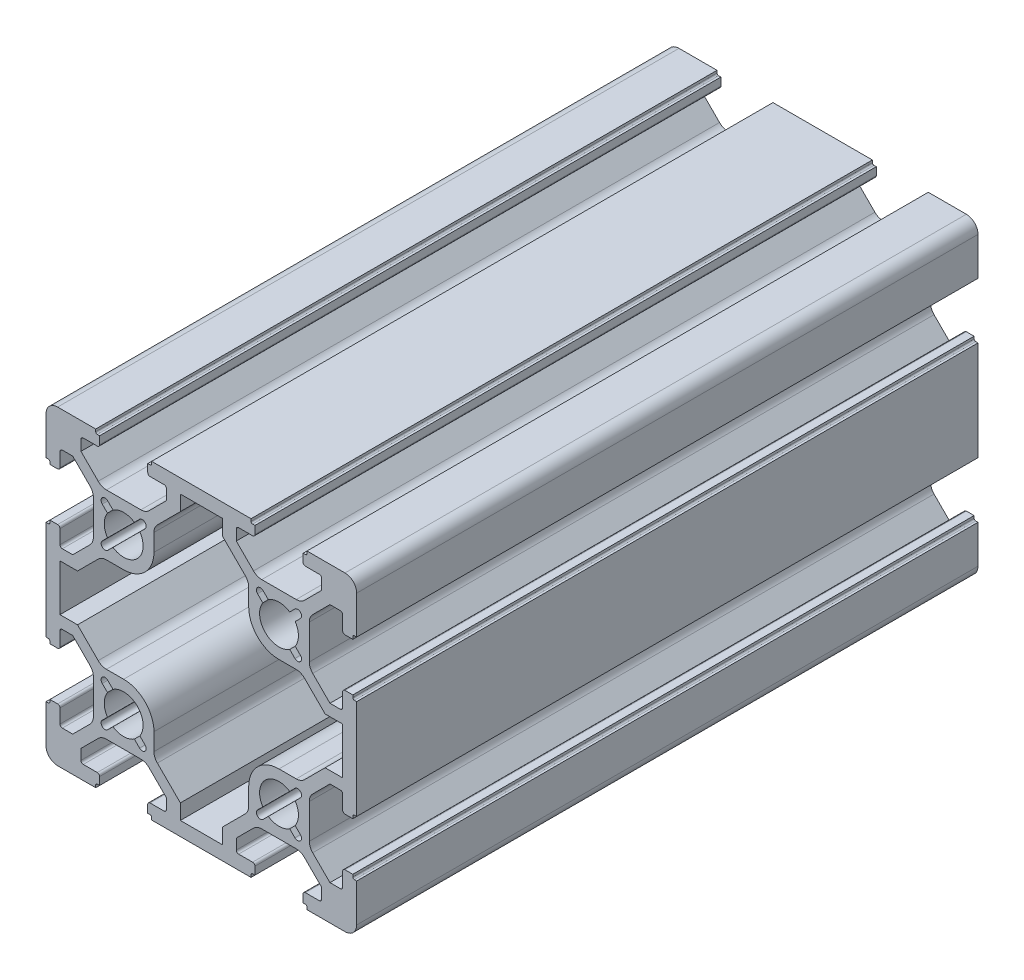
from build123d import *

# Parameters (mm, degrees)
EXTRUDE_1_DEPTH = 80


with BuildPart() as part:
    # 草图1 → 凸台-拉伸1 (new body)
    with BuildSketch(Plane.XY):
        with BuildLine():
            Line((583.863926702, 206.538663668), (578.963926702, 206.538663668))
            Line((578.963926702, 206.538663668), (578.963926702, 206.238663668))
            ThreePointArc((578.963926702, 206.238663668), (578.905348058, 206.097242312), (578.763926702, 206.038663668))
            Line((578.763926702, 206.038663668), (578.463926702, 206.038663668))
            Line((578.463926702, 206.038663668), (578.463926702, 205.038663668))
            ThreePointArc((578.463926702, 205.038663668), (578.551794668, 204.826531634), (578.763926702, 204.738663668))
            Line((578.763926702, 204.738663668), (580.563926702, 204.738663668))
            ThreePointArc((580.563926702, 204.738663668), (580.776058736, 204.650795703), (580.863926702, 204.438663668))
            Line((580.863926702, 204.438663668), (580.863926702, 203.098663668))
            Line((580.863926702, 203.098663668), (578.64326653, 200.878003496))
            ThreePointArc((578.64326653, 200.878003496), (578.156631507, 200.552844369), (577.582606358, 200.438663668))
            Line((577.582606358, 200.438663668), (573.145247045, 200.438663668))
            ThreePointArc((573.145247045, 200.438663668), (572.571221897, 200.552844369), (572.084586874, 200.878003496))
            Line((572.084586874, 200.878003496), (569.863926702, 203.098663668))
            Line((569.863926702, 203.098663668), (569.863926702, 204.438663668))
            ThreePointArc((569.863926702, 204.438663668), (569.951794668, 204.650795703), (570.163926702, 204.738663668))
            Line((570.163926702, 204.738663668), (571.963926702, 204.738663668))
            ThreePointArc((571.963926702, 204.738663668), (572.176058736, 204.826531634), (572.263926702, 205.038663668))
            Line((572.263926702, 205.038663668), (572.263926702, 206.038663668))
            Line((572.263926702, 206.038663668), (571.963926702, 206.038663668))
            ThreePointArc((571.963926702, 206.038663668), (571.822505346, 206.097242312), (571.763926702, 206.238663668))
            Line((571.763926702, 206.238663668), (571.763926702, 206.538663668))
            Line((571.763926702, 206.538663668), (566.863926702, 206.538663668))
            ThreePointArc((566.863926702, 206.538663668), (565.80326653, 206.09932384), (565.363926702, 205.038663668))
            Line((565.363926702, 205.038663668), (565.363926702, 200.138663668))
            Line((565.363926702, 200.138663668), (565.663926702, 200.138663668))
            ThreePointArc((565.663926702, 200.138663668), (565.805348058, 200.080085024), (565.863926702, 199.938663668))
            Line((565.863926702, 199.938663668), (565.863926702, 199.638663668))
            Line((565.863926702, 199.638663668), (566.863926702, 199.638663668))
            ThreePointArc((566.863926702, 199.638663668), (567.076058736, 199.726531634), (567.163926702, 199.938663668))
            Line((567.163926702, 199.938663668), (567.163926702, 201.738663668))
            ThreePointArc((567.163926702, 201.738663668), (567.251794668, 201.950795703), (567.463926702, 202.038663668))
            Line((567.463926702, 202.038663668), (568.803926702, 202.038663668))
            Line((568.803926702, 202.038663668), (571.024586874, 199.818003496))
            ThreePointArc((571.024586874, 199.818003496), (571.349746001, 199.331368473), (571.463926702, 198.757343325))
            Line((571.463926702, 198.757343325), (571.463926702, 194.319984012))
            ThreePointArc((571.463926702, 194.319984012), (571.349746001, 193.745958863), (571.024586874, 193.25932384))
            Line((571.024586874, 193.25932384), (568.803926702, 191.038663668))
            Line((568.803926702, 191.038663668), (567.463926702, 191.038663668))
            ThreePointArc((567.463926702, 191.038663668), (567.251794668, 191.126531634), (567.163926702, 191.338663668))
            Line((567.163926702, 191.338663668), (567.163926702, 193.138663668))
            ThreePointArc((567.163926702, 193.138663668), (567.076058736, 193.350795703), (566.863926702, 193.438663668))
            Line((566.863926702, 193.438663668), (565.863926702, 193.438663668))
            Line((565.863926702, 193.438663668), (565.863926702, 193.138663668))
            ThreePointArc((565.863926702, 193.138663668), (565.805348058, 192.997242312), (565.663926702, 192.938663668))
            Line((565.663926702, 192.938663668), (565.363926702, 192.938663668))
            Line((565.363926702, 192.938663668), (565.363926702, 180.138663668))
            Line((565.363926702, 180.138663668), (565.663926702, 180.138663668))
            ThreePointArc((565.663926702, 180.138663668), (565.805348058, 180.080085024), (565.863926702, 179.938663668))
            Line((565.863926702, 179.938663668), (565.863926702, 179.638663668))
            Line((565.863926702, 179.638663668), (566.863926702, 179.638663668))
            ThreePointArc((566.863926702, 179.638663668), (567.076058736, 179.726531634), (567.163926702, 179.938663668))
            Line((567.163926702, 179.938663668), (567.163926702, 181.738663668))
            ThreePointArc((567.163926702, 181.738663668), (567.251794668, 181.950795703), (567.463926702, 182.038663668))
            Line((567.463926702, 182.038663668), (568.803926702, 182.038663668))
            Line((568.803926702, 182.038663668), (571.024586874, 179.818003496))
            ThreePointArc((571.024586874, 179.818003496), (571.349746001, 179.331368473), (571.463926702, 178.757343325))
            Line((571.463926702, 178.757343325), (571.463926702, 174.319984012))
            ThreePointArc((571.463926702, 174.319984012), (571.349746001, 173.745958863), (571.024586874, 173.25932384))
            Line((571.024586874, 173.25932384), (568.803926702, 171.038663668))
            Line((568.803926702, 171.038663668), (567.463926702, 171.038663668))
            ThreePointArc((567.463926702, 171.038663668), (567.251794668, 171.126531634), (567.163926702, 171.338663668))
            Line((567.163926702, 171.338663668), (567.163926702, 173.138663668))
            ThreePointArc((567.163926702, 173.138663668), (567.076058736, 173.350795703), (566.863926702, 173.438663668))
            Line((566.863926702, 173.438663668), (565.863926702, 173.438663668))
            Line((565.863926702, 173.438663668), (565.863926702, 173.138663668))
            ThreePointArc((565.863926702, 173.138663668), (565.805348058, 172.997242312), (565.663926702, 172.938663668))
            Line((565.663926702, 172.938663668), (565.363926702, 172.938663668))
            Line((565.363926702, 172.938663668), (565.363926702, 168.038663668))
            ThreePointArc((565.363926702, 168.038663668), (565.80326653, 166.978003496), (566.863926702, 166.538663668))
            Line((566.863926702, 166.538663668), (571.763926702, 166.538663668))
            Line((571.763926702, 166.538663668), (571.763926702, 166.838663668))
            ThreePointArc((571.763926702, 166.838663668), (571.822505346, 166.980085024), (571.963926702, 167.038663668))
            Line((571.963926702, 167.038663668), (572.263926702, 167.038663668))
            Line((572.263926702, 167.038663668), (572.263926702, 168.038663668))
            ThreePointArc((572.263926702, 168.038663668), (572.176058736, 168.250795703), (571.963926702, 168.338663668))
            Line((571.963926702, 168.338663668), (570.163926702, 168.338663668))
            ThreePointArc((570.163926702, 168.338663668), (569.951794668, 168.426531634), (569.863926702, 168.638663668))
            Line((569.863926702, 168.638663668), (569.863926702, 169.978663668))
            Line((569.863926702, 169.978663668), (572.084586874, 172.19932384))
            ThreePointArc((572.084586874, 172.19932384), (572.571221897, 172.524482967), (573.145247045, 172.638663668))
            Line((573.145247045, 172.638663668), (577.582606358, 172.638663668))
            ThreePointArc((577.582606358, 172.638663668), (578.156631507, 172.524482967), (578.64326653, 172.19932384))
            Line((578.64326653, 172.19932384), (580.863926702, 169.978663668))
            Line((580.863926702, 169.978663668), (580.863926702, 168.638663668))
            ThreePointArc((580.863926702, 168.638663668), (580.776058736, 168.426531634), (580.563926702, 168.338663668))
            Line((580.563926702, 168.338663668), (578.763926702, 168.338663668))
            ThreePointArc((578.763926702, 168.338663668), (578.551794668, 168.250795703), (578.463926702, 168.038663668))
            Line((578.463926702, 168.038663668), (578.463926702, 167.038663668))
            Line((578.463926702, 167.038663668), (578.763926702, 167.038663668))
            ThreePointArc((578.763926702, 167.038663668), (578.905348058, 166.980085024), (578.963926702, 166.838663668))
            Line((578.963926702, 166.838663668), (578.963926702, 166.538663668))
            Line((578.963926702, 166.538663668), (583.863926702, 166.538663668))
            Line((583.863926702, 166.538663668), (586.863926702, 166.538663668))
            Line((586.863926702, 166.538663668), (591.763926702, 166.538663668))
            Line((591.763926702, 166.538663668), (591.763926702, 166.838663668))
            ThreePointArc((591.763926702, 166.838663668), (591.822505346, 166.980085024), (591.963926702, 167.038663668))
            Line((591.963926702, 167.038663668), (592.263926702, 167.038663668))
            Line((592.263926702, 167.038663668), (592.263926702, 168.038663668))
            ThreePointArc((592.263926702, 168.038663668), (592.176058736, 168.250795703), (591.963926702, 168.338663668))
            Line((591.963926702, 168.338663668), (590.163926702, 168.338663668))
            ThreePointArc((590.163926702, 168.338663668), (589.951794668, 168.426531634), (589.863926702, 168.638663668))
            Line((589.863926702, 168.638663668), (589.863926702, 169.978663668))
            Line((589.863926702, 169.978663668), (592.084586874, 172.19932384))
            ThreePointArc((592.084586874, 172.19932384), (592.571221897, 172.524482967), (593.145247045, 172.638663668))
            Line((593.145247045, 172.638663668), (597.582606358, 172.638663668))
            ThreePointArc((597.582606358, 172.638663668), (598.156631507, 172.524482967), (598.64326653, 172.19932384))
            Line((598.64326653, 172.19932384), (600.863926702, 169.978663668))
            Line((600.863926702, 169.978663668), (600.863926702, 168.638663668))
            ThreePointArc((600.863926702, 168.638663668), (600.776058736, 168.426531634), (600.563926702, 168.338663668))
            Line((600.563926702, 168.338663668), (598.763926702, 168.338663668))
            ThreePointArc((598.763926702, 168.338663668), (598.551794668, 168.250795703), (598.463926702, 168.038663668))
            Line((598.463926702, 168.038663668), (598.463926702, 167.038663668))
            Line((598.463926702, 167.038663668), (598.763926702, 167.038663668))
            ThreePointArc((598.763926702, 167.038663668), (598.905348058, 166.980085024), (598.963926702, 166.838663668))
            Line((598.963926702, 166.838663668), (598.963926702, 166.538663668))
            Line((598.963926702, 166.538663668), (603.863926702, 166.538663668))
            ThreePointArc((603.863926702, 166.538663668), (604.924586874, 166.978003496), (605.363926702, 168.038663668))
            Line((605.363926702, 168.038663668), (605.363926702, 172.938663668))
            Line((605.363926702, 172.938663668), (605.063926702, 172.938663668))
            ThreePointArc((605.063926702, 172.938663668), (604.922505346, 172.997242312), (604.863926702, 173.138663668))
            Line((604.863926702, 173.138663668), (604.863926702, 173.438663668))
            Line((604.863926702, 173.438663668), (603.863926702, 173.438663668))
            ThreePointArc((603.863926702, 173.438663668), (603.651794668, 173.350795703), (603.563926702, 173.138663668))
            Line((603.563926702, 173.138663668), (603.563926702, 171.338663668))
            ThreePointArc((603.563926702, 171.338663668), (603.476058736, 171.126531634), (603.263926702, 171.038663668))
            Line((603.263926702, 171.038663668), (601.923926702, 171.038663668))
            Line((601.923926702, 171.038663668), (599.70326653, 173.25932384))
            ThreePointArc((599.70326653, 173.25932384), (599.378107403, 173.745958863), (599.263926702, 174.319984012))
            Line((599.263926702, 174.319984012), (599.263926702, 178.757343325))
            ThreePointArc((599.263926702, 178.757343325), (599.378107403, 179.331368473), (599.70326653, 179.818003496))
            Line((599.70326653, 179.818003496), (601.923926702, 182.038663668))
            Line((601.923926702, 182.038663668), (603.263926702, 182.038663668))
            ThreePointArc((603.263926702, 182.038663668), (603.476058736, 181.950795703), (603.563926702, 181.738663668))
            Line((603.563926702, 181.738663668), (603.563926702, 179.938663668))
            ThreePointArc((603.563926702, 179.938663668), (603.651794668, 179.726531634), (603.863926702, 179.638663668))
            Line((603.863926702, 179.638663668), (604.863926702, 179.638663668))
            Line((604.863926702, 179.638663668), (604.863926702, 179.938663668))
            ThreePointArc((604.863926702, 179.938663668), (604.922505346, 180.080085024), (605.063926702, 180.138663668))
            Line((605.063926702, 180.138663668), (605.363926702, 180.138663668))
            Line((605.363926702, 180.138663668), (605.363926702, 192.938663668))
            Line((605.363926702, 192.938663668), (605.063926702, 192.938663668))
            ThreePointArc((605.063926702, 192.938663668), (604.922505346, 192.997242312), (604.863926702, 193.138663668))
            Line((604.863926702, 193.138663668), (604.863926702, 193.438663668))
            Line((604.863926702, 193.438663668), (603.863926702, 193.438663668))
            ThreePointArc((603.863926702, 193.438663668), (603.651794668, 193.350795703), (603.563926702, 193.138663668))
            Line((603.563926702, 193.138663668), (603.563926702, 191.338663668))
            ThreePointArc((603.563926702, 191.338663668), (603.476058736, 191.126531634), (603.263926702, 191.038663668))
            Line((603.263926702, 191.038663668), (601.923926702, 191.038663668))
            Line((601.923926702, 191.038663668), (599.70326653, 193.25932384))
            ThreePointArc((599.70326653, 193.25932384), (599.378107403, 193.745958863), (599.263926702, 194.319984012))
            Line((599.263926702, 194.319984012), (599.263926702, 198.757343325))
            ThreePointArc((599.263926702, 198.757343325), (599.378107403, 199.331368473), (599.70326653, 199.818003496))
            Line((599.70326653, 199.818003496), (601.923926702, 202.038663668))
            Line((601.923926702, 202.038663668), (603.263926702, 202.038663668))
            ThreePointArc((603.263926702, 202.038663668), (603.476058736, 201.950795703), (603.563926702, 201.738663668))
            Line((603.563926702, 201.738663668), (603.563926702, 199.938663668))
            ThreePointArc((603.563926702, 199.938663668), (603.651794668, 199.726531634), (603.863926702, 199.638663668))
            Line((603.863926702, 199.638663668), (604.863926702, 199.638663668))
            Line((604.863926702, 199.638663668), (604.863926702, 199.938663668))
            ThreePointArc((604.863926702, 199.938663668), (604.922505346, 200.080085024), (605.063926702, 200.138663668))
            Line((605.063926702, 200.138663668), (605.363926702, 200.138663668))
            Line((605.363926702, 200.138663668), (605.363926702, 205.038663668))
            ThreePointArc((605.363926702, 205.038663668), (604.924586874, 206.09932384), (603.863926702, 206.538663668))
            Line((603.863926702, 206.538663668), (598.963926702, 206.538663668))
            Line((598.963926702, 206.538663668), (598.963926702, 206.238663668))
            ThreePointArc((598.963926702, 206.238663668), (598.905348058, 206.097242312), (598.763926702, 206.038663668))
            Line((598.763926702, 206.038663668), (598.463926702, 206.038663668))
            Line((598.463926702, 206.038663668), (598.463926702, 205.038663668))
            ThreePointArc((598.463926702, 205.038663668), (598.551794668, 204.826531634), (598.763926702, 204.738663668))
            Line((598.763926702, 204.738663668), (600.563926702, 204.738663668))
            ThreePointArc((600.563926702, 204.738663668), (600.776058736, 204.650795703), (600.863926702, 204.438663668))
            Line((600.863926702, 204.438663668), (600.863926702, 203.098663668))
            Line((600.863926702, 203.098663668), (598.64326653, 200.878003496))
            ThreePointArc((598.64326653, 200.878003496), (598.156631507, 200.552844369), (597.582606358, 200.438663668))
            Line((597.582606358, 200.438663668), (593.145247045, 200.438663668))
            ThreePointArc((593.145247045, 200.438663668), (592.571221897, 200.552844369), (592.084586874, 200.878003496))
            Line((592.084586874, 200.878003496), (589.863926702, 203.098663668))
            Line((589.863926702, 203.098663668), (589.863926702, 204.438663668))
            ThreePointArc((589.863926702, 204.438663668), (589.951794668, 204.650795703), (590.163926702, 204.738663668))
            Line((590.163926702, 204.738663668), (591.963926702, 204.738663668))
            ThreePointArc((591.963926702, 204.738663668), (592.176058736, 204.826531634), (592.263926702, 205.038663668))
            Line((592.263926702, 205.038663668), (592.263926702, 206.038663668))
            Line((592.263926702, 206.038663668), (591.963926702, 206.038663668))
            ThreePointArc((591.963926702, 206.038663668), (591.822505346, 206.097242312), (591.763926702, 206.238663668))
            Line((591.763926702, 206.238663668), (591.763926702, 206.538663668))
            Line((591.763926702, 206.538663668), (586.863926702, 206.538663668))
            Line((586.863926702, 206.538663668), (583.863926702, 206.538663668))
        make_face()
        with BuildLine():
            Line((579.263926702, 196.538663668), (579.263926702, 198.757343325))
            ThreePointArc((579.263926702, 198.757343325), (579.378107403, 199.331368473), (579.70326653, 199.818003496))
            Line((579.70326653, 199.818003496), (582.663926702, 202.778663668))
            Line((582.663926702, 202.778663668), (582.663926702, 204.738663668))
            Line((582.663926702, 204.738663668), (588.063926702, 204.738663668))
            Line((588.063926702, 204.738663668), (588.063926702, 202.778663668))
            Line((588.063926702, 202.778663668), (591.024586874, 199.818003496))
            ThreePointArc((591.024586874, 199.818003496), (591.349746001, 199.331368473), (591.463926702, 198.757343325))
            Line((591.463926702, 198.757343325), (591.463926702, 196.538663668))
            ThreePointArc((591.463926702, 196.538663668), (592.606210255, 193.780947222), (595.363926702, 192.638663668))
            Line((595.363926702, 192.638663668), (597.582606358, 192.638663668))
            ThreePointArc((597.582606358, 192.638663668), (598.156631507, 192.524482967), (598.64326653, 192.19932384))
            Line((598.64326653, 192.19932384), (601.303926702, 189.538663668))
            Line((601.303926702, 189.538663668), (603.563926702, 189.538663668))
            Line((603.563926702, 189.538663668), (603.563926702, 183.538663668))
            Line((603.563926702, 183.538663668), (601.303926702, 183.538663668))
            Line((601.303926702, 183.538663668), (598.64326653, 180.878003496))
            ThreePointArc((598.64326653, 180.878003496), (598.156631507, 180.552844369), (597.582606358, 180.438663668))
            Line((597.582606358, 180.438663668), (595.363926702, 180.438663668))
            ThreePointArc((595.363926702, 180.438663668), (592.606210255, 179.296380115), (591.463926702, 176.538663668))
            Line((591.463926702, 176.538663668), (591.463926702, 174.319984012))
            ThreePointArc((591.463926702, 174.319984012), (591.349746001, 173.745958863), (591.024586874, 173.25932384))
            Line((591.024586874, 173.25932384), (588.063926702, 170.298663668))
            Line((588.063926702, 170.298663668), (588.063926702, 168.338663668))
            Line((588.063926702, 168.338663668), (582.663926702, 168.338663668))
            Line((582.663926702, 168.338663668), (582.663926702, 170.298663668))
            Line((582.663926702, 170.298663668), (579.70326653, 173.25932384))
            ThreePointArc((579.70326653, 173.25932384), (579.378107403, 173.745958863), (579.263926702, 174.319984012))
            Line((579.263926702, 174.319984012), (579.263926702, 176.538663668))
            ThreePointArc((579.263926702, 176.538663668), (578.121643149, 179.296380115), (575.363926702, 180.438663668))
            Line((575.363926702, 180.438663668), (573.145247045, 180.438663668))
            ThreePointArc((573.145247045, 180.438663668), (572.571221897, 180.552844369), (572.084586874, 180.878003496))
            Line((572.084586874, 180.878003496), (569.423926702, 183.538663668))
            Line((569.423926702, 183.538663668), (567.163926702, 183.538663668))
            Line((567.163926702, 183.538663668), (567.163926702, 189.538663668))
            Line((567.163926702, 189.538663668), (569.423926702, 189.538663668))
            Line((569.423926702, 189.538663668), (572.084586874, 192.19932384))
            ThreePointArc((572.084586874, 192.19932384), (572.571221897, 192.524482967), (573.145247045, 192.638663668))
            Line((573.145247045, 192.638663668), (575.363926702, 192.638663668))
            ThreePointArc((575.363926702, 192.638663668), (578.121643149, 193.780947222), (579.263926702, 196.538663668))
        make_face(mode=Mode.SUBTRACT)
        with BuildLine():
            Line((577.414536367, 199.296380115), (576.742424119, 198.624267866))
            ThreePointArc((576.742424119, 198.624267866), (575.363926702, 199.038663668), (573.985429285, 198.624267866))
            Line((573.985429285, 198.624267866), (573.313317036, 199.296380115))
            ThreePointArc((573.313317036, 199.296380115), (572.606210255, 199.296380115), (572.606210255, 198.589273334))
            Line((572.606210255, 198.589273334), (573.278322504, 197.917161085))
            ThreePointArc((573.278322504, 197.917161085), (572.863926702, 196.538663668), (573.278322504, 195.160166251))
            Line((573.278322504, 195.160166251), (572.606210255, 194.488054003))
            ThreePointArc((572.606210255, 194.488054003), (572.606210255, 193.780947222), (573.313317036, 193.780947222))
            Line((573.313317036, 193.780947222), (573.985429285, 194.45305947))
            ThreePointArc((573.985429285, 194.45305947), (577.131693655, 194.770896715), (577.4495309, 197.917161085))
            Line((577.4495309, 197.917161085), (578.121643149, 198.589273334))
            ThreePointArc((578.121643149, 198.589273334), (578.121643149, 199.296380115), (577.414536367, 199.296380115))
        make_face(mode=Mode.SUBTRACT)
        with BuildLine():
            Line((593.313317036, 199.296380115), (593.985429285, 198.624267866))
            ThreePointArc((593.985429285, 198.624267866), (595.363926702, 199.038663668), (596.742424119, 198.624267866))
            Line((596.742424119, 198.624267866), (597.414536367, 199.296380115))
            ThreePointArc((597.414536367, 199.296380115), (598.121643149, 199.296380115), (598.121643149, 198.589273334))
            Line((598.121643149, 198.589273334), (597.4495309, 197.917161085))
            ThreePointArc((597.4495309, 197.917161085), (597.863926702, 196.538663668), (597.4495309, 195.160166251))
            Line((597.4495309, 195.160166251), (598.121643149, 194.488054003))
            ThreePointArc((598.121643149, 194.488054003), (598.121643149, 193.780947222), (597.414536367, 193.780947222))
            Line((597.414536367, 193.780947222), (596.742424119, 194.45305947))
            ThreePointArc((596.742424119, 194.45305947), (593.596159749, 194.770896715), (593.278322504, 197.917161085))
            Line((593.278322504, 197.917161085), (592.606210255, 198.589273334))
            ThreePointArc((592.606210255, 198.589273334), (592.606210255, 199.296380115), (593.313317036, 199.296380115))
        make_face(mode=Mode.SUBTRACT)
        with BuildLine():
            Line((577.414536367, 173.780947222), (576.742424119, 174.45305947))
            ThreePointArc((576.742424119, 174.45305947), (575.363926702, 174.038663668), (573.985429285, 174.45305947))
            Line((573.985429285, 174.45305947), (573.313317036, 173.780947222))
            ThreePointArc((573.313317036, 173.780947222), (572.606210255, 173.780947222), (572.606210255, 174.488054003))
            Line((572.606210255, 174.488054003), (573.278322504, 175.160166251))
            ThreePointArc((573.278322504, 175.160166251), (572.863926702, 176.538663668), (573.278322504, 177.917161085))
            Line((573.278322504, 177.917161085), (572.606210255, 178.589273334))
            ThreePointArc((572.606210255, 178.589273334), (572.606210255, 179.296380115), (573.313317036, 179.296380115))
            Line((573.313317036, 179.296380115), (573.985429285, 178.624267866))
            ThreePointArc((573.985429285, 178.624267866), (577.131693655, 178.306430621), (577.4495309, 175.160166251))
            Line((577.4495309, 175.160166251), (578.121643149, 174.488054003))
            ThreePointArc((578.121643149, 174.488054003), (578.121643149, 173.780947222), (577.414536367, 173.780947222))
        make_face(mode=Mode.SUBTRACT)
        with BuildLine():
            Line((593.313317036, 173.780947222), (593.985429285, 174.45305947))
            ThreePointArc((593.985429285, 174.45305947), (595.363926702, 174.038663668), (596.742424119, 174.45305947))
            Line((596.742424119, 174.45305947), (597.414536367, 173.780947222))
            ThreePointArc((597.414536367, 173.780947222), (598.121643149, 173.780947222), (598.121643149, 174.488054003))
            Line((598.121643149, 174.488054003), (597.4495309, 175.160166251))
            ThreePointArc((597.4495309, 175.160166251), (597.863926702, 176.538663668), (597.4495309, 177.917161085))
            Line((597.4495309, 177.917161085), (598.121643149, 178.589273334))
            ThreePointArc((598.121643149, 178.589273334), (598.121643149, 179.296380115), (597.414536367, 179.296380115))
            Line((597.414536367, 179.296380115), (596.742424119, 178.624267866))
            ThreePointArc((596.742424119, 178.624267866), (593.596159749, 178.306430621), (593.278322504, 175.160166251))
            Line((593.278322504, 175.160166251), (592.606210255, 174.488054003))
            ThreePointArc((592.606210255, 174.488054003), (592.606210255, 173.780947222), (593.313317036, 173.780947222))
        make_face(mode=Mode.SUBTRACT)
    extrude(amount=EXTRUDE_1_DEPTH)


solid = part.part
